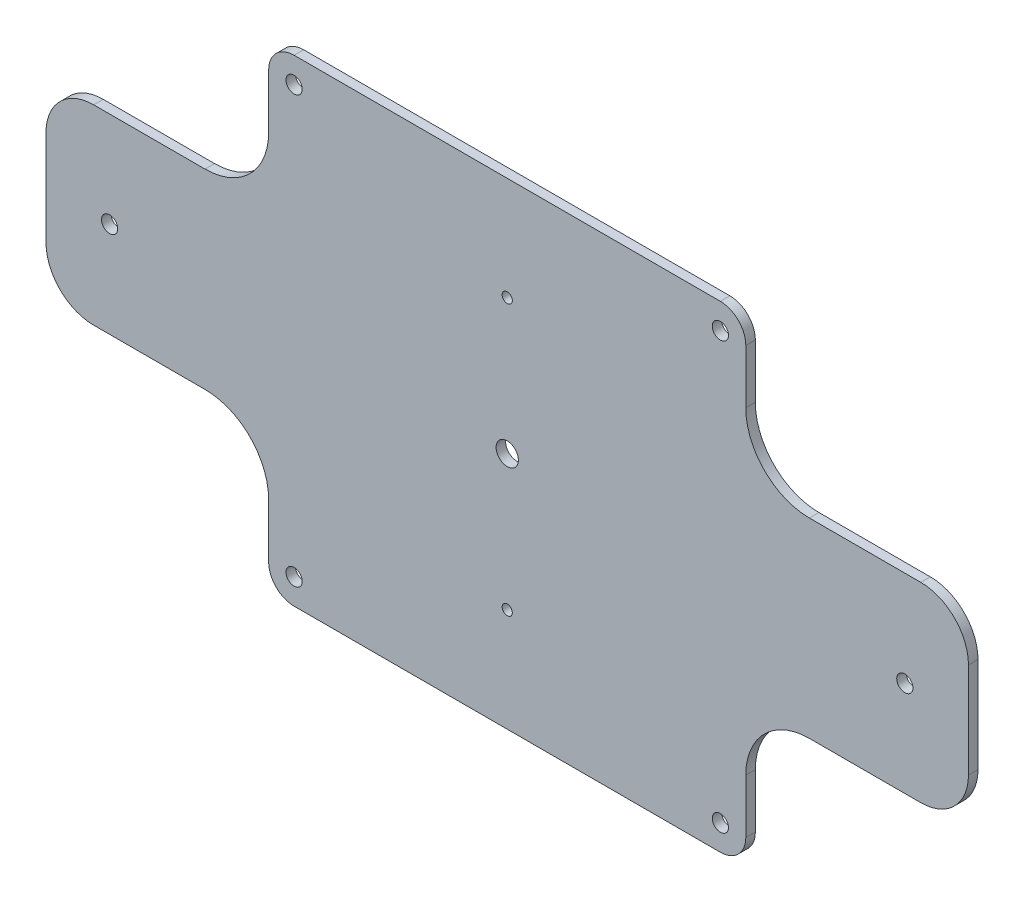
from build123d import *

# Parameters (mm, degrees)
SKETCH_1_W          = 150
SKETCH_1_H          = 150
EXTRUDE_1_DEPTH     = 3
SKETCH_4_R          = 2.55
SKETCH_4_R_2        = 3.5
CUT_EXTRUDE_3_DEPTH = 7
FILLET_1_R          = 8
SKETCH_6_W          = 70
SKETCH_6_H          = 60
SKETCH_6_R          = 2.55
EXTRUDE_2_DEPTH     = 3
FILLET_2_R          = 20
FILLET_3_R          = 15
SKETCH_7_R          = 1.6
CUT_EXTRUDE_5_DEPTH = 10


with BuildPart() as part:
    # 草图1 → 凸台-拉伸1 (new body)
    with BuildSketch(Plane.XY):
        Rectangle(SKETCH_1_W, SKETCH_1_H)
    extrude(amount=EXTRUDE_1_DEPTH)

    # 草图4 → 切除-拉伸3 (cut)
    with BuildSketch(Plane.XY.offset(3)):
        with Locations((-67, 67)):
            Circle(SKETCH_4_R)
        with Locations((-67, -67)):
            Circle(SKETCH_4_R)
        with Locations((67, -67)):
            Circle(SKETCH_4_R)
        with Locations((67, 67)):
            Circle(SKETCH_4_R)
        Circle(SKETCH_4_R_2)
    extrude(amount=-CUT_EXTRUDE_3_DEPTH, mode=Mode.SUBTRACT)

    # 圆角1
    fillet_1_edges = [part.edges().sort_by_distance(p)[0] for p in [
        (75, -75, 1.5),
        (-75, -75, 1.5),
        (-75, 75, 1.5),
        (75, 75, 1.5),
    ]]
    fillet(fillet_1_edges, radius=FILLET_1_R)

    # 草图6 → 凸台-拉伸2 (add)
    with BuildSketch(Plane.XY.offset(3)):
        with Locations((-110, 0)):
            Rectangle(SKETCH_6_W, SKETCH_6_H)
        with Locations((-125, 0)):
            Circle(SKETCH_6_R, mode=Mode.SUBTRACT)
    extrude_2 = extrude(amount=-EXTRUDE_2_DEPTH)

    # 镜向1: 凸台-拉伸2 across plane
    add(extrude_2.mirror(Plane(origin=(0, 0, 0), x_dir=(0, 0, 1), z_dir=(1, 0, 0))))

    # 圆角2
    fillet_2_edges = [part.edges().sort_by_distance(p)[0] for p in [
        (-75, -30, 1.5),
        (-75, 30, 1.5),
        (75, -30, 1.5),
        (75, 30, 1.5),
    ]]
    fillet(fillet_2_edges, radius=FILLET_2_R)

    # 圆角3
    fillet_3_edges = [part.edges().sort_by_distance(p)[0] for p in [
        (-145, 30, 1.5),
        (-145, -30, 1.5),
        (145, 30, 1.5),
        (145, -30, 1.5),
    ]]
    fillet(fillet_3_edges, radius=FILLET_3_R)

    # 草图7 → 切除-拉伸5 (cut)
    with BuildSketch(Plane.XY.offset(3)):
        with Locations((0, 42.5)):
            Circle(SKETCH_7_R)
        with Locations((0, -42.5)):
            Circle(SKETCH_7_R)
    extrude(amount=-CUT_EXTRUDE_5_DEPTH, mode=Mode.SUBTRACT)


solid = part.part
